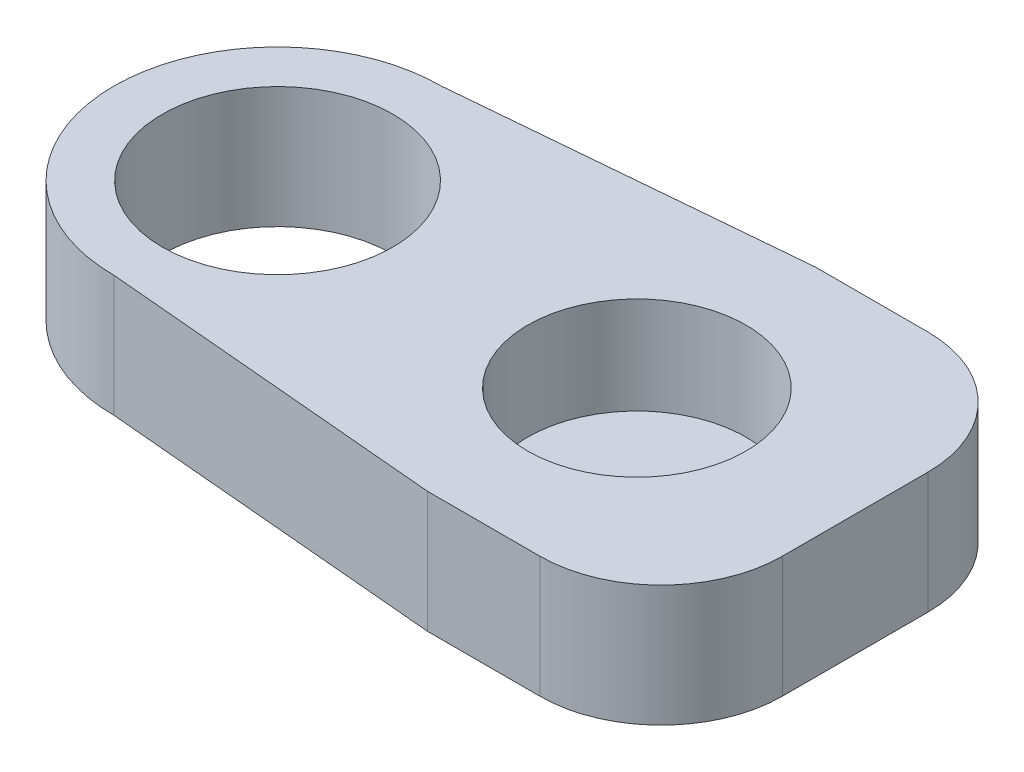
from build123d import *

# Parameters (mm, degrees)
SKETCH1_R           = 4.75
BOSS_EXTRUDE1_DEPTH = 5
SKETCH2_R           = 4.5
CUT_EXTRUDE1_DEPTH  = 4


with BuildPart() as part:
    # Sketch1 → Boss-Extrude1 (new body)
    with BuildSketch(Plane(origin=(0, 0, 0), x_dir=(1, 0, 0), z_dir=(0, 1, 0))):
        with BuildLine():
            Line((5.649139951, 8), (10.28, 8))
            ThreePointArc((10.28, 8), (13.815533906, 6.535533906), (15.28, 3))
            Line((15.28, 3), (15.28, -3))
            ThreePointArc((15.28, -3), (13.815533906, -6.535533906), (10.28, -8))
            Line((10.28, -8), (5.649139951, -8))
            Line((5.649139951, -8), (-8.529960299, -6.75))
            ThreePointArc((-8.529960299, -6.75), (-13.302950922, -4.772978995), (-15.28, 0))
            ThreePointArc((-15.28, 0), (-13.302950922, 4.772978995), (-8.529960299, 6.75))
            Line((-8.529960299, 6.75), (5.649139951, 8))
        make_face()
        with Locations(Location((-8.529960299, 0, 0), (0, 0, 270))):
            Circle(SKETCH1_R, mode=Mode.SUBTRACT)
    extrude(amount=BOSS_EXTRUDE1_DEPTH)

    # Sketch2 → Cut-Extrude1 (cut)
    with BuildSketch(Plane(origin=(0, 5, 0), x_dir=(1, 0, 0), z_dir=(0, 1, 0))):
        with Locations(Location((6.280039701, 0, 0), (0, 0, 270))):
            Circle(SKETCH2_R)
    extrude(amount=-CUT_EXTRUDE1_DEPTH, mode=Mode.SUBTRACT)


solid = part.part
